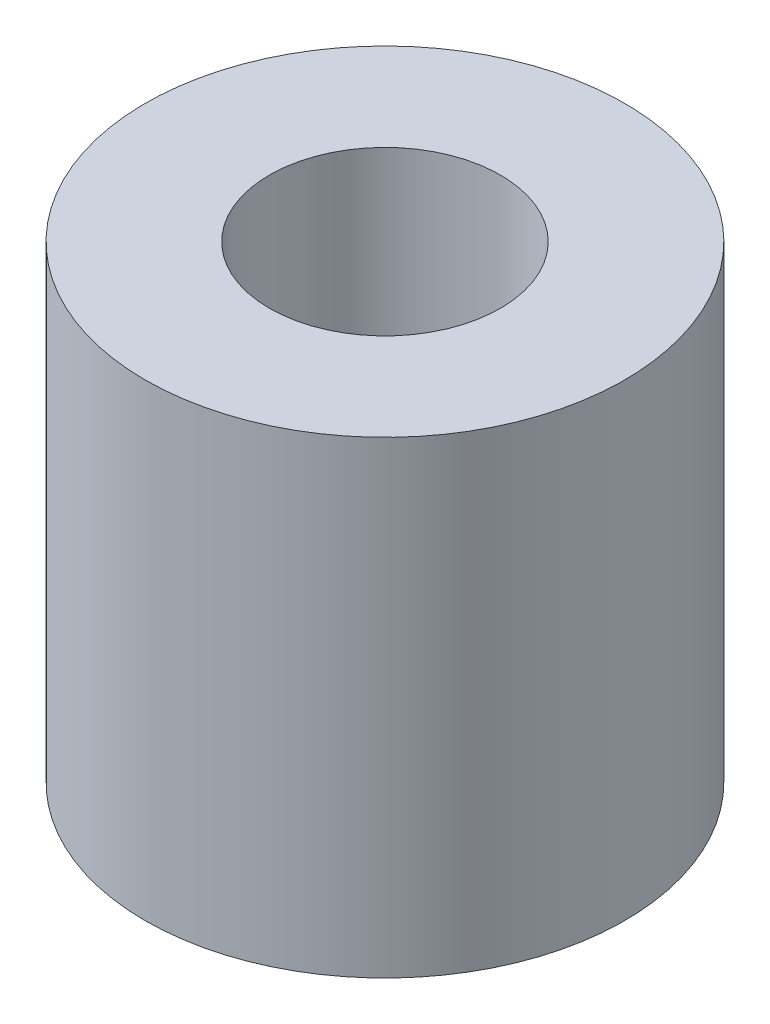
from build123d import *

# Parameters (mm, degrees)
SKETCH_1_R      = 2.558770985
SKETCH_1_R_2    = 1.232989381
EXTRUDE_1_DEPTH = 2.5


with BuildPart() as part:
    # 草图1 → 凸台-拉伸1 (new, symmetric)
    with BuildSketch(Plane(origin=(0, 0, 0), x_dir=(1, 0, 0), z_dir=(0, 1, 0))):
        Circle(SKETCH_1_R)
        Circle(SKETCH_1_R_2, mode=Mode.SUBTRACT)
    extrude(amount=EXTRUDE_1_DEPTH, both=True)


solid = part.part
